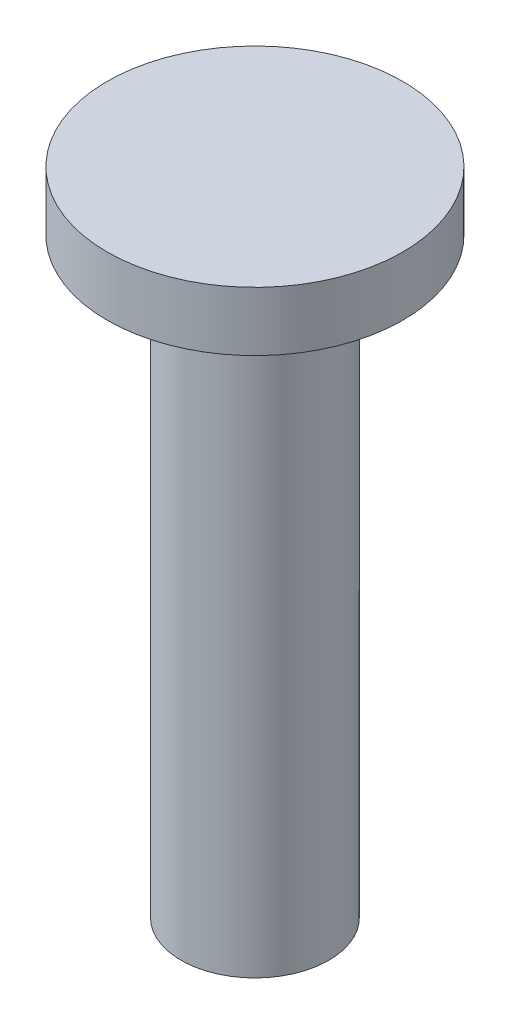
from build123d import *

# Parameters (mm, degrees)
SKETCH_1_R      = 2
EXTRUDE_1_DEPTH = 0.8
SKETCH_2_R      = 1
EXTRUDE_2_DEPTH = 8


with BuildPart() as part:
    # 草图1 → 凸台-拉伸1 (new body)
    with BuildSketch(Plane(origin=(0, 0, 0), x_dir=(1, 0, 0), z_dir=(0, 1, 0))):
        with Locations(Location((0, 0, 0), (0, 0, 270))):
            Circle(SKETCH_1_R)
    extrude(amount=EXTRUDE_1_DEPTH)

    # 草图2 → 凸台-拉伸2 (add)
    with BuildSketch(Plane.XZ):
        with Locations(Location((0, 0, 0), (0, 0, 270))):
            Circle(SKETCH_2_R)
    extrude(amount=EXTRUDE_2_DEPTH)


solid = part.part
